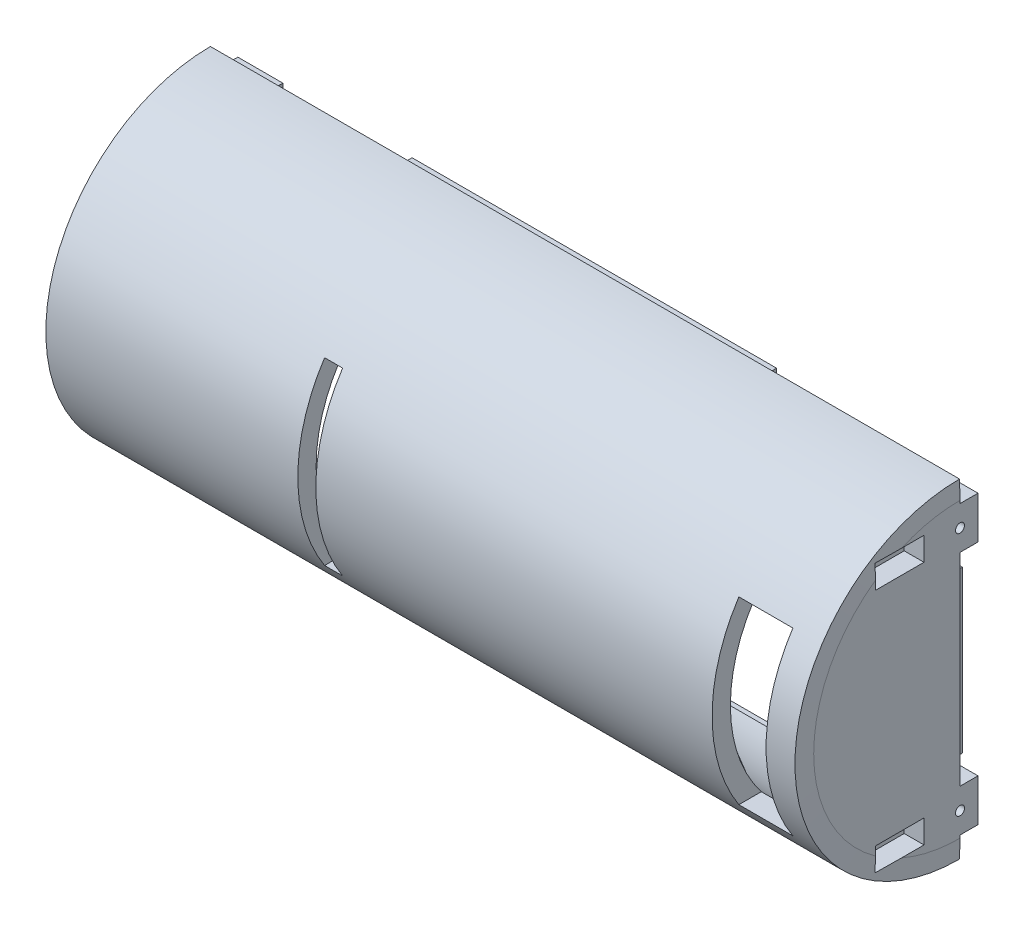
from build123d import *

# Parameters (mm, degrees)
REVOLVE2_ANGLE           = 180
SKETCH5_W                = 2.5
SKETCH5_H                = 12.5
SKETCH5_W_2              = 101.25
SKETCH5_H_2              = 2.5
SKETCH5_W_3              = 12.5
BOSS_EXTRUDE1_DEPTH      = 2.54
SKETCH7_W                = 20
SKETCH7_H                = 50
CUT_EXTRUDE1_DEPTH       = 7
BOSS_EXTRUDE3_REACH      = 220.035
SKETCH8_W                = 5
SKETCH8_H                = 91.44
SKETCH9_W                = 6.129296028
SKETCH9_H                = 8.078685473
BOSS_EXTRUDE4_DEPTH      = 2
BOSS_EXTRUDE7_START      = 8
BOSS_EXTRUDE7_DEPTH      = 8
BOSS_EXTRUDE8_REACH      = 220.035
BOSS_EXTRUDE8_END_RADIUS = 40.64
SKETCH13_W               = 75.08
SKETCH13_H               = 60.08
SKETCH13_W_2             = 70
SKETCH13_H_2             = 55
SKETCH14_W               = 75.08
SKETCH14_H               = 60.08
CUT_EXTRUDE3_DEPTH       = 11
BOSS_EXTRUDE9_REACH      = 217.997
SKETCH15_W               = 70
SKETCH15_H               = 55
CUT_EXTRUDE5_DEPTH       = 15
CUT_EXTRUDE6_REACH       = 202.84
SKETCH18_W               = 12
SKETCH18_H               = 56
BOSS_EXTRUDE10_REACH     = 220.035
SKETCH23_W               = 6
SKETCH23_H               = 81.28
SKETCH26_W               = 6
SKETCH26_H               = 11.75
BOSS_EXTRUDE11_DEPTH     = 5
SKETCH27_W               = 13.5
SKETCH27_H               = 6.5
CUT_EXTRUDE7_DEPTH       = 5.5
CUT_EXTRUDE8_REACH       = 220.035
SKETCH28_R               = 1.25
SKETCH29_R               = 3.125
CUT_EXTRUDE9_DEPTH       = 2.5
SKETCH30_W               = 5
SKETCH30_H               = 50
SKETCH30_W_2             = 15
CUT_EXTRUDE10_DEPTH      = 216.996710059
SKETCH32_W               = 2.25
SKETCH32_H               = 44.75
BOSS_EXTRUDE12_DEPTH     = 2.54


with BuildPart() as part:
    # Sketch2 → Revolve2 (revolve)
    with BuildSketch(Plane.XY):
        Polygon((0, 0), (0, 40.64), (0, 45.72), (25.4, 45.72), (195.4, 45.72), (208.1, 45.72), (208.22771659, 40.64), (195.52771659, 40.64), (25.4, 40.64), (5.08, 40.64), (5.08, 0), align=None)
    revolve(axis=Axis((0, 0, 0), (1, 0, 0)), revolution_arc=REVOLVE2_ANGLE)

    # Sketch5 → Boss-Extrude1 (add)
    with BuildSketch(Plane(origin=(0, 0, 0), x_dir=(-1, 0, 0), z_dir=(0, 0, -1))):
        with Locations((-2.54, 34.39)):
            Rectangle(SKETCH5_W, SKETCH5_H)
        with Locations((-104.113858295, -43.18)):
            Rectangle(SKETCH5_W_2, SKETCH5_H_2)
        with Locations((-11.33, 43.18)):
            Rectangle(SKETCH5_W_3, SKETCH5_H_2)
        with Locations((-104.113858295, 43.18)):
            Rectangle(SKETCH5_W_2, SKETCH5_H_2)
        with Locations((-11.33, -43.18)):
            Rectangle(SKETCH5_W_3, SKETCH5_H_2)
        with Locations((-2.54, -34.39)):
            Rectangle(SKETCH5_W, SKETCH5_H)
    extrude(amount=BOSS_EXTRUDE1_DEPTH)

    # Sketch7 → Cut-Extrude1 (cut)
    with BuildSketch(Plane.ZY):
        with Locations((10, 0)):
            Rectangle(SKETCH7_W, SKETCH7_H)
    extrude(amount=-CUT_EXTRUDE1_DEPTH, mode=Mode.SUBTRACT)

    # Sketch8 → Boss-Extrude3 (add, up to next)
    with BuildSketch(Plane(origin=(0, 0, 0), x_dir=(-1, 0, 0), z_dir=(0, 0, -1)), mode=Mode.PRIVATE) as boss_extrude3_sk1:
        with Locations((-15.58, 0)):
            Rectangle(SKETCH8_W, SKETCH8_H)
    boss_extrude3_tool1 = extrude(boss_extrude3_sk1.sketch, amount=-BOSS_EXTRUDE3_REACH, mode=Mode.PRIVATE) - part.part
    add(boss_extrude3_tool1.solids().sort_by_distance((15.58, 0, 0))[0])

    # Sketch9 → Boss-Extrude4 (add)
    with BuildSketch(Plane(origin=(5.08, 0, 0), x_dir=(0, 0, -1), z_dir=(1, 0, 0))):
        with Locations((-3.906446672, 33.952493663)):
            Rectangle(SKETCH9_W, SKETCH9_H)
    extrude(amount=BOSS_EXTRUDE4_DEPTH)

    # Sketch12 → Boss-Extrude7 (add)
    with BuildSketch(Plane.ZY.offset(-13.08).offset(BOSS_EXTRUDE7_START)):
        with BuildLine():
            Line((23.64, 33.056920607), (23.64, -33.056920607))
            ThreePointArc((23.64, -33.056920607), (40.64, 0), (23.64, 33.056920607))
        make_face()
    extrude(amount=-BOSS_EXTRUDE7_DEPTH)

    # Boss-Extrude8: up to this cylinder (the profile starts inside it)
    boss_extrude8_end = Plane(origin=(117.54, 0, 0), z_dir=(-1, 0, 0)) * Cylinder(BOSS_EXTRUDE8_END_RADIUS, 522.35, mode=Mode.PRIVATE)
    # Sketch13 → Boss-Extrude8 (add, up to the surface)
    with BuildSketch(Plane(origin=(0, 0, 0), x_dir=(-1, 0, 0), z_dir=(0, 0, -1)), mode=Mode.PRIVATE) as boss_extrude8_sk1:
        with Locations((-117.54, 0)):
            Rectangle(SKETCH13_W, SKETCH13_H)
        with Locations((-117.54, 0)):
            Rectangle(SKETCH13_W_2, SKETCH13_H_2, mode=Mode.SUBTRACT)
    boss_extrude8_tool1 = extrude(boss_extrude8_sk1.sketch, amount=-BOSS_EXTRUDE8_REACH, mode=Mode.PRIVATE) & boss_extrude8_end
    add(boss_extrude8_tool1.solids().sort_by_distance((117.54, 29.078407, 0))[0])

    # Sketch14 → Cut-Extrude3 (cut)
    with BuildSketch(Plane(origin=(0, 0, 0), x_dir=(-1, 0, 0), z_dir=(0, 0, -1))):
        with Locations((-117.54, 0)):
            Rectangle(SKETCH14_W, SKETCH14_H)
    extrude(amount=-CUT_EXTRUDE3_DEPTH, mode=Mode.SUBTRACT)

    # Sketch15 → Boss-Extrude9 (add, up to next)
    with BuildSketch(Plane(origin=(0, 0, 11), x_dir=(-1, 0, 0), z_dir=(0, 0, -1)), mode=Mode.PRIVATE) as boss_extrude9_sk1:
        with Locations((-117.54, 0)):
            Rectangle(SKETCH15_W, SKETCH15_H)
    boss_extrude9_tool1 = extrude(boss_extrude9_sk1.sketch, amount=-BOSS_EXTRUDE9_REACH, mode=Mode.PRIVATE) - part.part
    add(boss_extrude9_tool1.solids().sort_by_distance((117.54, 0, 11))[0])

    # Sketch17 → Cut-Extrude5 (cut)
    with BuildSketch(Plane(origin=(0, 0, 11), x_dir=(-1, 0, 0), z_dir=(0, 0, -1))):
        Polygon((-82.54, 27.5), (-152.54, 27.5), (-152.54, 19.5), (-155.08, 19.5), (-155.08, 5.5), (-152.54, 5.5), (-152.54, -13.5), (-155.08, -13.5), (-155.08, -24.5), (-152.54, -24.5), (-152.54, -27.5), (-82.54, -27.5), align=None)
    extrude(amount=-CUT_EXTRUDE5_DEPTH, mode=Mode.SUBTRACT)

    # Sketch18 → Cut-Extrude6 (cut, up to next)
    with BuildSketch(Plane(origin=(18.08, 0, 0), x_dir=(0, 0, -1), z_dir=(1, 0, 0)), mode=Mode.PRIVATE) as cut_extrude6_sk1:
        with Locations((-6, -10.004795356)):
            Rectangle(SKETCH18_W, SKETCH18_H)
    cut_extrude6_tool1 = extrude(cut_extrude6_sk1.sketch, amount=-CUT_EXTRUDE6_REACH, mode=Mode.PRIVATE) & part.part
    add(cut_extrude6_tool1.solids().sort_by_distance((18.08, -10.004795, 6))[0], mode=Mode.SUBTRACT)

    # Sketch23 → Boss-Extrude10 (add, up to next)
    with BuildSketch(Plane(origin=(0, 0, 0), x_dir=(-1, 0, 0), z_dir=(0, 0, -1)), mode=Mode.PRIVATE) as boss_extrude10_sk1:
        with Locations((-205.22771659, 0)):
            Rectangle(SKETCH23_W, SKETCH23_H)
    boss_extrude10_tool1 = extrude(boss_extrude10_sk1.sketch, amount=-BOSS_EXTRUDE10_REACH, mode=Mode.PRIVATE) - part.part
    add(boss_extrude10_tool1.solids().sort_by_distance((205.227717, 0, 0))[0])

    # Sketch26 → Boss-Extrude11 (add)
    with BuildSketch(Plane(origin=(0, 0, 0), x_dir=(-1, 0, 0), z_dir=(0, 0, -1))):
        with Locations((-205.22771659, 34)):
            Rectangle(SKETCH26_W, SKETCH26_H)
        with Locations((-205.22771659, -34)):
            Rectangle(SKETCH26_W, SKETCH26_H)
    extrude(amount=BOSS_EXTRUDE11_DEPTH)

    # Sketch27 → Cut-Extrude7 (cut)
    with BuildSketch(Plane(origin=(208.22771659, 0, 0), x_dir=(0, 0, -1), z_dir=(1, 0, 0))):
        with Locations((-16.75, -34)):
            Rectangle(SKETCH27_W, SKETCH27_H)
        with Locations((-16.75, 34)):
            Rectangle(SKETCH27_W, SKETCH27_H)
    extrude(amount=-CUT_EXTRUDE7_DEPTH, mode=Mode.SUBTRACT)

    # Sketch28 → Cut-Extrude8 (cut, up to next)
    with BuildSketch(Plane(origin=(208.22771659, 0, 0), x_dir=(0, 0, -1), z_dir=(1, 0, 0)), mode=Mode.PRIVATE) as cut_extrude8_sk1:
        with Locations((0, 34)):
            Circle(SKETCH28_R)
    cut_extrude8_tool1 = extrude(cut_extrude8_sk1.sketch, amount=-CUT_EXTRUDE8_REACH, mode=Mode.PRIVATE) & part.part
    # Sketch28 → Cut-Extrude8 (cut, up to next)
    with BuildSketch(Plane(origin=(208.22771659, 0, 0), x_dir=(0, 0, -1), z_dir=(1, 0, 0)), mode=Mode.PRIVATE) as cut_extrude8_sk2:
        with Locations((0, -34)):
            Circle(SKETCH28_R)
    cut_extrude8_tool2 = extrude(cut_extrude8_sk2.sketch, amount=-CUT_EXTRUDE8_REACH, mode=Mode.PRIVATE) & part.part
    add(cut_extrude8_tool1.solids().sort_by_distance((208.227717, 34, 0))[0], mode=Mode.SUBTRACT)
    add(cut_extrude8_tool2.solids().sort_by_distance((208.227717, -34, 0))[0], mode=Mode.SUBTRACT)

    # Sketch29 → Cut-Extrude9 (cut)
    with BuildSketch(Plane.ZY.offset(-202.22771659)):
        with Locations((0, -34)):
            Circle(SKETCH29_R)
        with Locations((0, 34)):
            Circle(SKETCH29_R)
    extrude(amount=-CUT_EXTRUDE9_DEPTH, mode=Mode.SUBTRACT)

    # Sketch30 → Cut-Extrude10 (cut, through all)
    with BuildSketch(Plane(origin=(0, 0, 11), x_dir=(-1, 0, 0), z_dir=(0, 0, -1))):
        with Locations((-72.5, 0)):
            Rectangle(SKETCH30_W, SKETCH30_H)
        with Locations((-192.58, 0)):
            Rectangle(SKETCH30_W_2, SKETCH30_H)
    extrude(amount=-CUT_EXTRUDE10_DEPTH, mode=Mode.SUBTRACT)

    # Sketch32 → Boss-Extrude12 (add)
    with BuildSketch(Plane(origin=(0, 0, 0), x_dir=(-1, 0, 0), z_dir=(0, 0, -1))):
        with Locations((-205.22771659, 0)):
            Rectangle(SKETCH32_W, SKETCH32_H)
    extrude(amount=BOSS_EXTRUDE12_DEPTH)


solid = part.part
